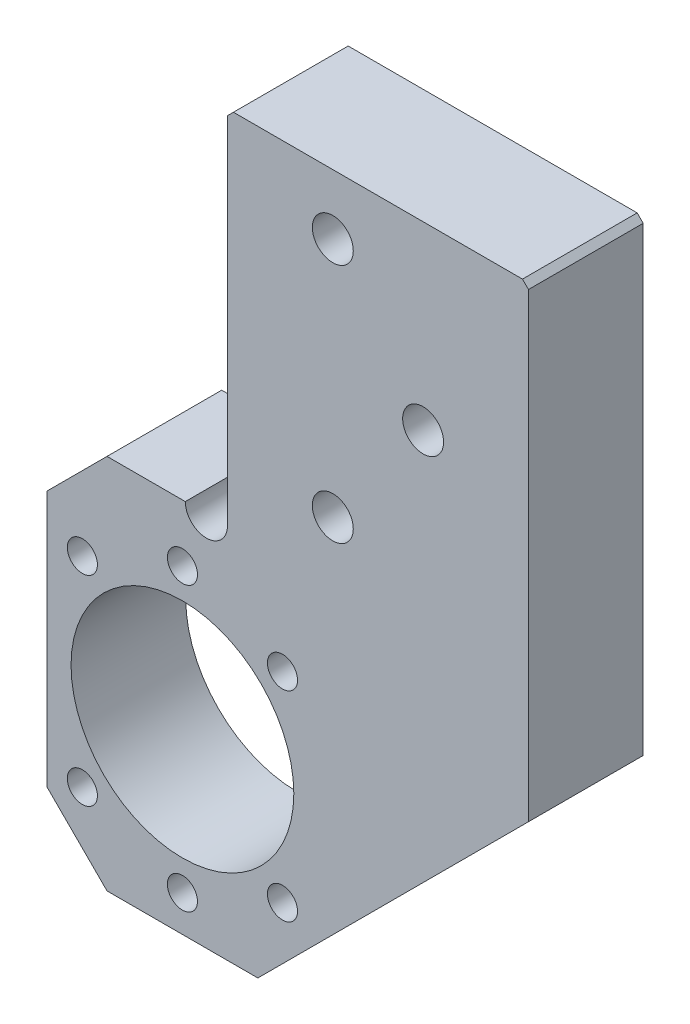
from build123d import *

# Parameters (mm, degrees)
SKETCH1_R              = 18.5
BOSS_EXTRUDE1_DEPTH    = 9.525
M8X1_25_TAPPED_HOLE1_D = 6.8
TAPPED_HOLE0_D         = 5
CHAMFER1_SIZE          = 1


with BuildPart() as part:
    # Sketch1 → Boss-Extrude1 (new, symmetric)
    with BuildSketch(Plane.XY):
        with BuildLine():
            Line((0.475, 33), (-12.525, 33))
            Line((-12.525, 33), (-22.525, 23))
            Line((-22.525, 23), (-22.525, -19.5))
            Line((-22.525, -19.5), (-12.525, -29.5))
            Line((-12.525, -29.5), (12.525, -29.5))
            Line((12.525, -29.5), (57.475, 15.45))
            Line((57.475, 15.45), (57.475, 93))
            Line((57.475, 93), (7.475, 93))
            Line((7.475, 93), (7.475, 33))
            ThreePointArc((7.475, 33), (3.975, 29.5), (0.475, 33))
        make_face()
        with Locations(Location((0, 0, 0), (0, 0, 180))):
            Circle(SKETCH1_R, mode=Mode.SUBTRACT)
    extrude(amount=BOSS_EXTRUDE1_DEPTH, both=True)

    # M8x1.25 Tapped Hole1 (through all)
    with Locations(Plane.XY.offset(9.525)):
        with Locations((24.975, 43), (39.975, 63), (24.975, 83)):
            Hole(M8X1_25_TAPPED_HOLE1_D / 2)

    # Tapped Hole0 (through all)
    with Locations(Plane.XY.offset(9.525)):
        with Locations((0, 23.5), (-16.617009358, 16.617009358), (16.617009358, 16.617009358), (16.617009358, -16.617009358), (0, -23.5), (-16.617009358, -16.617009358)):
            Hole(TAPPED_HOLE0_D / 2)

    # Chamfer1
    chamfer1_edges = [part.edges().sort_by_distance(p)[0] for p in [
        (7.475, 93, 0),
        (57.475, 93, 0),
    ]]
    chamfer(chamfer1_edges, length=CHAMFER1_SIZE)


solid = part.part
